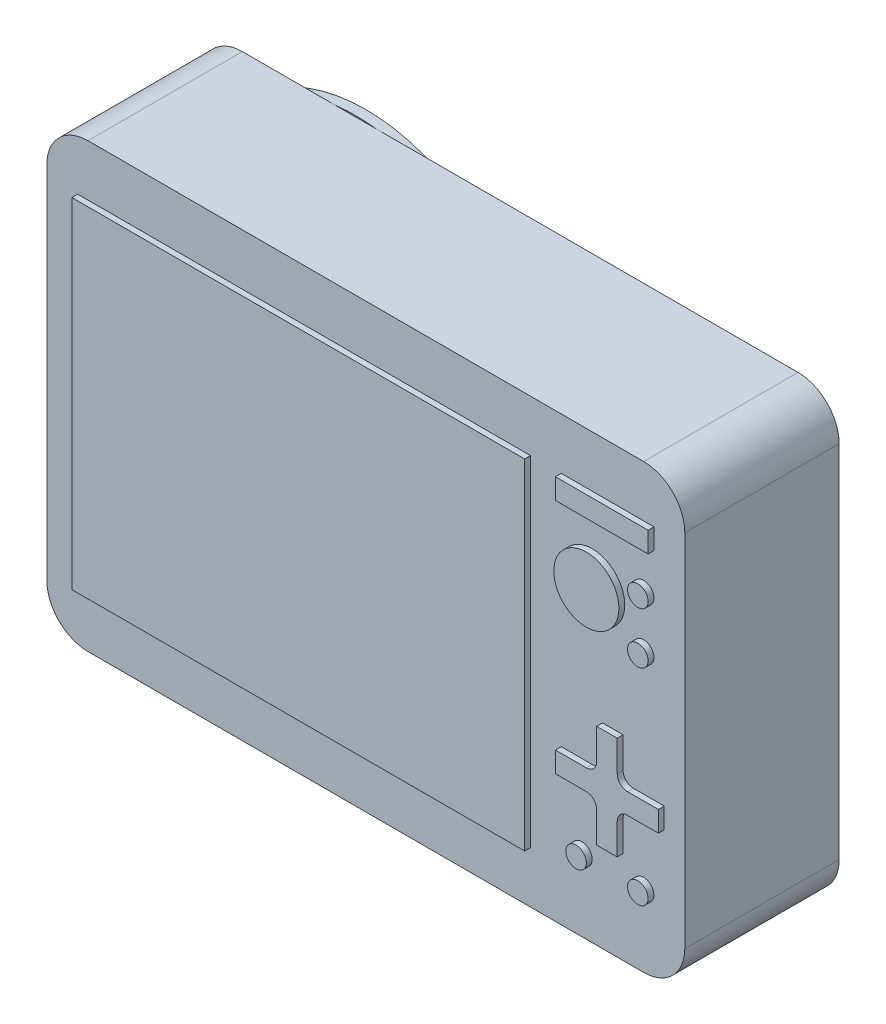
from build123d import *

# Parameters (mm, degrees)
EXTRUDE1_DEPTH     = 1
EXTRUDE9_DEPTH     = 21.8125
EXTRUDE10_DEPTH    = 1
SKETCH14_R         = 1.5875
SKETCH14_R_2       = 5.020115786
SKETCH14_W         = 69.85
SKETCH14_H         = 52.3875
SKETCH14_W_2       = 14.2875
SKETCH14_H_2       = 3.175
EXTRUDE12_DEPTH    = 0.9
CUT_EXTRUDE5_DEPTH = 0.2
EXTRUDE13_DEPTH    = 1.5875
SKETCH17_W         = 19.05
SKETCH17_H         = 12.7
CUT_EXTRUDE6_DEPTH = 1.5
SKETCH18_R         = 4.7625
EXTRUDE14_DEPTH    = 0.4
SKETCH19_R         = 2.5
CUT_EXTRUDE7_DEPTH = 1


with BuildPart() as part:
    # Sketch1 → Extrude1 (new body)
    with BuildSketch(Plane.XY):
        with BuildLine():
            Line((-42.8625, 34.925), (42.8625, 34.925))
            ThreePointArc((42.8625, 34.925), (47.352628061, 33.065128061), (49.2125, 28.575))
            Line((49.2125, 28.575), (49.2125, -26.9875))
            ThreePointArc((49.2125, -26.9875), (47.352628061, -31.477628061), (42.8625, -33.3375))
            Line((42.8625, -33.3375), (-42.8625, -33.3375))
            ThreePointArc((-42.8625, -33.3375), (-47.352628061, -31.477628061), (-49.2125, -26.9875))
            Line((-49.2125, -26.9875), (-49.2125, 28.575))
            ThreePointArc((-49.2125, 28.575), (-47.352628061, 33.065128061), (-42.8625, 34.925))
        make_face()
    extrude(amount=EXTRUDE1_DEPTH)

    # Sketch11 → Extrude9 (add)
    with BuildSketch(Plane.XY.offset(1)):
        with BuildLine():
            Line((-42.8625, 34.925), (42.8625, 34.925))
            ThreePointArc((42.8625, 34.925), (47.352628061, 33.065128061), (49.2125, 28.575))
            Line((49.2125, 28.575), (49.2125, -26.9875))
            ThreePointArc((49.2125, -26.9875), (47.352628061, -31.477628061), (42.8625, -33.3375))
            Line((42.8625, -33.3375), (-42.8625, -33.3375))
            ThreePointArc((-42.8625, -33.3375), (-47.352628061, -31.477628061), (-49.2125, -26.9875))
            Line((-49.2125, -26.9875), (-49.2125, 28.575))
            ThreePointArc((-49.2125, 28.575), (-47.352628061, 33.065128061), (-42.8625, 34.925))
        make_face()
        with BuildLine():
            Line((-42.8625, 33.3375), (42.8625, 33.3375))
            ThreePointArc((42.8625, 33.3375), (46.230096045, 31.942596045), (47.625, 28.575))
            Line((47.625, 28.575), (47.625, -26.9875))
            ThreePointArc((47.625, -26.9875), (46.230096045, -30.355096045), (42.8625, -31.75))
            Line((42.8625, -31.75), (-42.8625, -31.75))
            ThreePointArc((-42.8625, -31.75), (-46.230096045, -30.355096045), (-47.625, -26.9875))
            Line((-47.625, -26.9875), (-47.625, 28.575))
            ThreePointArc((-47.625, 28.575), (-46.230096045, 31.942596045), (-42.8625, 33.3375))
        make_face(mode=Mode.SUBTRACT)
    extrude(amount=EXTRUDE9_DEPTH)

    # Sketch13 → Extrude10 (add)
    with BuildSketch(Plane.XY.offset(22.8125)):
        with BuildLine():
            Line((-42.8625, 34.925), (42.8625, 34.925))
            ThreePointArc((42.8625, 34.925), (47.352628061, 33.065128061), (49.2125, 28.575))
            Line((49.2125, 28.575), (49.2125, -26.9875))
            ThreePointArc((49.2125, -26.9875), (47.352628061, -31.477628061), (42.8625, -33.3375))
            Line((42.8625, -33.3375), (-42.8625, -33.3375))
            ThreePointArc((-42.8625, -33.3375), (-47.352628061, -31.477628061), (-49.2125, -26.9875))
            Line((-49.2125, -26.9875), (-49.2125, 28.575))
            ThreePointArc((-49.2125, 28.575), (-47.352628061, 33.065128061), (-42.8625, 34.925))
        make_face()
    extrude(amount=EXTRUDE10_DEPTH)

    # Sketch14 → Extrude12 (add)
    with BuildSketch(Plane.XY.offset(23.8125)):
        with Locations(Location((42.8625, 17.4625, 0), (0, 0, 180))):
            Circle(SKETCH14_R)
        with Locations(Location((42.8625, 9.525, 0), (0, 0, 180))):
            Circle(SKETCH14_R)
        with Locations(Location((34.925, 14.2875, 0), (0, 0, 180))):
            Circle(SKETCH14_R_2)
        with Locations(Location((33.3375, -22.225, 0), (0, 0, 180))):
            Circle(SKETCH14_R)
        with Locations(Location((42.8625, -22.225, 0), (0, 0, 180))):
            Circle(SKETCH14_R)
        with BuildLine():
            Line((36.5125, -7.9375), (36.5125, -3.175))
            Line((36.5125, -3.175), (39.6875, -3.175))
            Line((39.6875, -3.175), (39.6875, -7.9375))
            ThreePointArc((39.6875, -7.9375), (40.152467985, -9.060032015), (41.275, -9.525))
            Line((41.275, -9.525), (46.0375, -9.525))
            Line((46.0375, -9.525), (46.0375, -12.7))
            Line((46.0375, -12.7), (41.275, -12.7))
            ThreePointArc((41.275, -12.7), (40.152467985, -13.164967985), (39.6875, -14.2875))
            Line((39.6875, -14.2875), (39.6875, -19.05))
            Line((39.6875, -19.05), (36.5125, -19.05))
            Line((36.5125, -19.05), (36.5125, -14.2875))
            ThreePointArc((36.5125, -14.2875), (36.047532015, -13.164967985), (34.925, -12.7))
            Line((34.925, -12.7), (30.1625, -12.7))
            Line((30.1625, -12.7), (30.1625, -9.525))
            Line((30.1625, -9.525), (34.925, -9.525))
            ThreePointArc((34.925, -9.525), (36.047532015, -9.060032015), (36.5125, -7.9375))
        make_face()
        with Locations((-9.525, 0.79375)):
            Rectangle(SKETCH14_W, SKETCH14_H)
        with Locations((37.30625, 25.4)):
            Rectangle(SKETCH14_W_2, SKETCH14_H_2)
    extrude(amount=EXTRUDE12_DEPTH)

    # Sketch15 → Cut-Extrude5 (cut)
    with BuildSketch(Plane(origin=(0, 0, 0), x_dir=(-1, 0, 0), z_dir=(0, 0, -1))):
        with BuildLine():
            Line((3.175, 30.1625), (-28.575, 30.1625))
            ThreePointArc((-28.575, 30.1625), (-29.697532015, 29.697532015), (-30.1625, 28.575))
            Line((-30.1625, 28.575), (-30.1625, 25.4))
            ThreePointArc((-30.1625, 25.4), (-29.697532015, 24.277467985), (-28.575, 23.8125))
            Line((-28.575, 23.8125), (3.175, 19.05))
            ThreePointArc((3.175, 19.05), (4.297532015, 19.514967985), (4.7625, 20.6375))
            Line((4.7625, 20.6375), (4.7625, 28.575))
            ThreePointArc((4.7625, 28.575), (4.297532015, 29.697532015), (3.175, 30.1625))
        make_face()
    extrude(amount=-CUT_EXTRUDE5_DEPTH, mode=Mode.SUBTRACT)

    # Sketch16 → Extrude13 (add)
    with BuildSketch(Plane(origin=(0, 0, 0), x_dir=(-1, 0, 0), z_dir=(0, 0, -1))):
        with BuildLine():
            ThreePointArc((12.7, 31.75), (25.4, 35.122668351), (38.1, 31.75))
            ThreePointArc((38.1, 31.75), (40.730256121, 25.4), (38.1, 19.05))
            ThreePointArc((38.1, 19.05), (25.4, 15.677331649), (12.7, 19.05))
            ThreePointArc((12.7, 19.05), (10.069743879, 25.4), (12.7, 31.75))
        make_face()
    extrude(amount=EXTRUDE13_DEPTH)

    # Sketch17 → Cut-Extrude6 (cut)
    with BuildSketch(Plane(origin=(0, 0, -1.5875), x_dir=(-1, 0, 0), z_dir=(0, 0, -1))):
        with Locations((25.4, 25.4)):
            Rectangle(SKETCH17_W, SKETCH17_H)
    extrude(amount=-CUT_EXTRUDE6_DEPTH, mode=Mode.SUBTRACT)

    # Sketch18 → Extrude14 (add)
    with BuildSketch(Plane.XZ.offset(33.3375)):
        with Locations(Location((0, 11.1125, 0), (0, 0, 180))):
            Circle(SKETCH18_R)
    extrude(amount=EXTRUDE14_DEPTH)

    # Sketch19 → Cut-Extrude7 (cut)
    with BuildSketch(Plane.XZ.offset(33.7375)):
        with Locations((0, 11.1125)):
            Circle(SKETCH19_R)
    extrude(amount=-CUT_EXTRUDE7_DEPTH, mode=Mode.SUBTRACT)


solid = part.part
